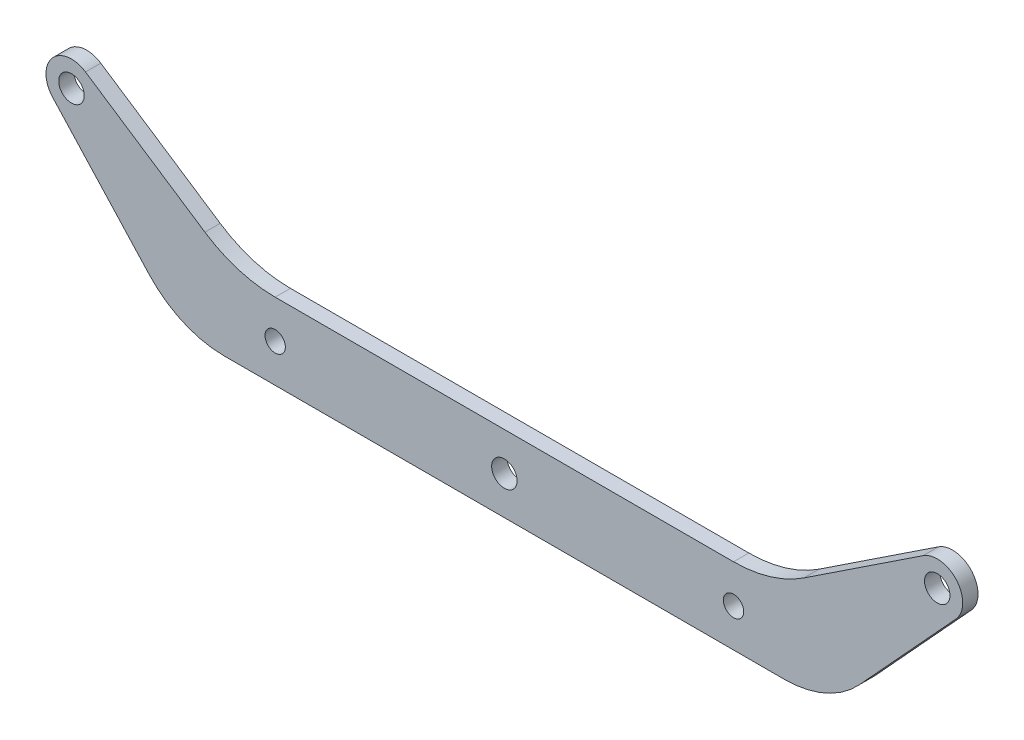
from build123d import *

# Parameters (mm, degrees)
SKETCH_1_R      = 2.5
SKETCH_1_R_2    = 2
EXTRUDE_1_DEPTH = 3


with BuildPart() as part:
    # 草图1 → 凸台-拉伸1 (new body)
    with BuildSketch(Plane.XY):
        with BuildLine():
            Line((-55, -30.5), (0, -30.5))
            Line((0, -30.5), (55, -30.5))
            ThreePointArc((55, -30.5), (63.046888376, -28.809767542), (69.733665561, -24.024758746))
            Line((69.733665561, -24.024758746), (88.68341639, -3.381189686))
            ThreePointArc((88.68341639, -3.381189686), (88.803421515, 3.245610078), (82.240225301, 4.16936969))
            Line((82.240225301, 4.16936969), (58.798873493, -11.346848451))
            ThreePointArc((58.798873493, -11.346848451), (52.205164423, -14.439206454), (45, -15.5))
            Line((45, -15.5), (0, -15.5))
            Line((0, -15.5), (-45, -15.5))
            ThreePointArc((-45, -15.5), (-52.205164423, -14.439206454), (-58.798873493, -11.346848451))
            Line((-58.798873493, -11.346848451), (-82.240225301, 4.16936969))
            ThreePointArc((-82.240225301, 4.16936969), (-88.803421515, 3.245610078), (-88.68341639, -3.381189686))
            Line((-88.68341639, -3.381189686), (-69.733665561, -24.024758746))
            ThreePointArc((-69.733665561, -24.024758746), (-63.046888376, -28.809767542), (-55, -30.5))
        make_face()
        with Locations((85, 0)):
            Circle(SKETCH_1_R, mode=Mode.SUBTRACT)
        with Locations((-85, 0)):
            Circle(SKETCH_1_R, mode=Mode.SUBTRACT)
        with Locations((0, -23)):
            Circle(SKETCH_1_R, mode=Mode.SUBTRACT)
        with Locations((-45, -23)):
            Circle(SKETCH_1_R_2, mode=Mode.SUBTRACT)
        with Locations((45, -23)):
            Circle(SKETCH_1_R_2, mode=Mode.SUBTRACT)
    extrude(amount=EXTRUDE_1_DEPTH)


solid = part.part
